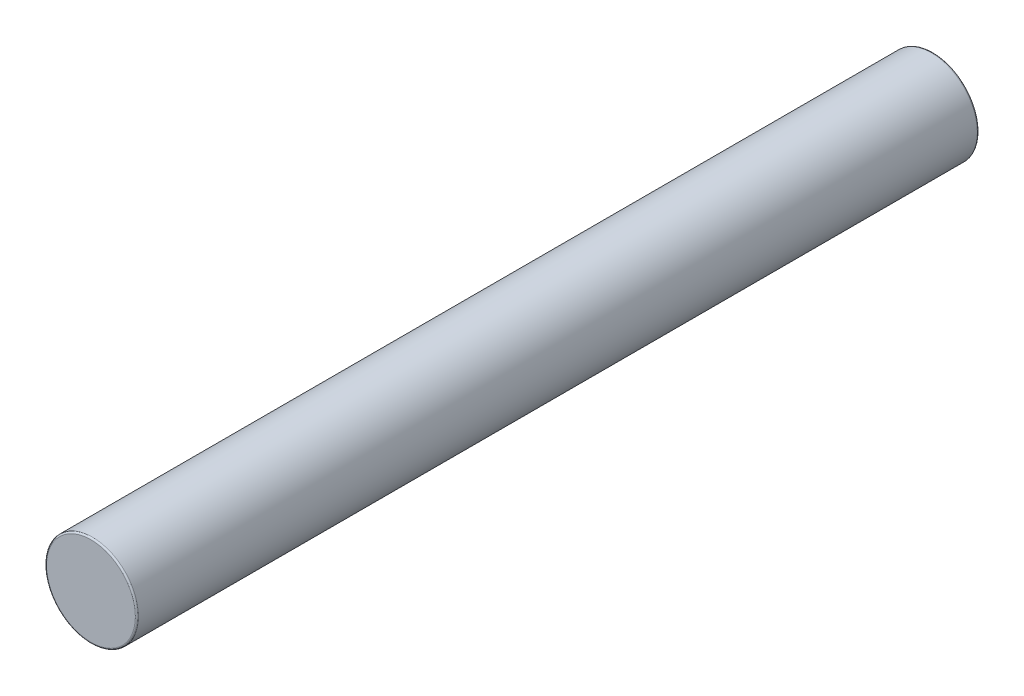
from build123d import *

# Parameters (mm, degrees)
SKETCH_1_R      = 3
EXTRUDE_1_DEPTH = 55
FILLET_1_R      = 0.1


with BuildPart() as part:
    # Эскиз1 → Бобышка-Вытянуть1 (new body)
    with BuildSketch(Plane.XY):
        Circle(SKETCH_1_R)
    extrude(amount=EXTRUDE_1_DEPTH)

    # Скругление1
    fillet_1_edges = [part.edges().sort_by_distance(p)[0] for p in [
        (-3, 0, 0),
        (-3, 0, 55),
    ]]
    fillet(fillet_1_edges, radius=FILLET_1_R)


solid = part.part
